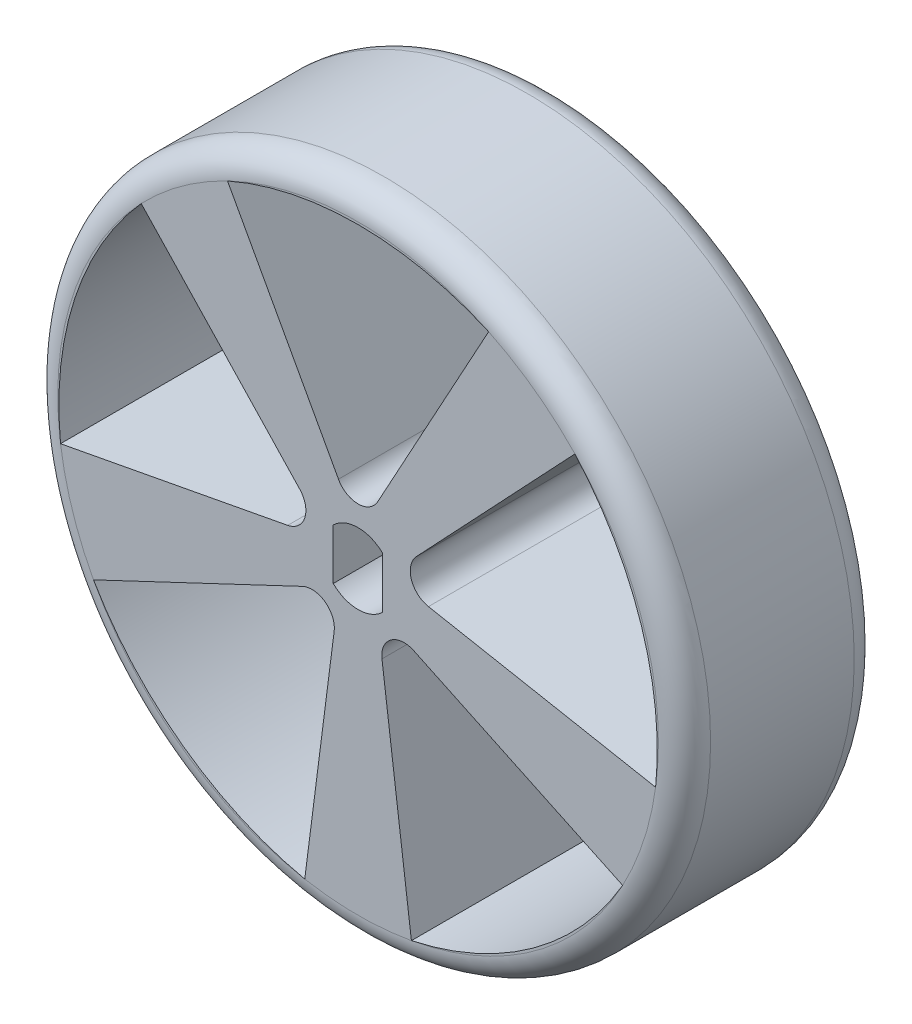
from build123d import *

# Parameters (mm, degrees)
SKETCH1_R           = 25
BOSS_EXTRUDE1_DEPTH = 15
FILLET1_R           = 2
CUT_EXTRUDE1_DEPTH  = 4
SKETCH7_R           = 1.04
CUT_EXTRUDE2_DEPTH  = 39.405728804
CUT_EXTRUDE3_REACH  = 40.406
CIRPATTERN1_COUNT   = 5


with BuildPart() as part:
    # Sketch1 → Boss-Extrude1 (new body)
    with BuildSketch(Plane.XY):
        Circle(SKETCH1_R)
    extrude(amount=BOSS_EXTRUDE1_DEPTH)

    # Fillet1
    fillet1_edges = [part.edges().sort_by_distance(p)[0] for p in [
        (-25, 0, 0),
        (-25, 0, 15),
    ]]
    fillet(fillet1_edges, radius=FILLET1_R)

    # Sketch4 → Cut-Extrude1 (cut)
    with BuildSketch(Plane.XY.offset(15)):
        with BuildLine():
            Line((-1.902969848, 1.941233493), (-1.902969848, -1.941233493))
            ThreePointArc((-1.902969848, -1.941233493), (-0.030378036, -2.71822716), (1.859110772, -1.983277302))
            Line((1.859110772, -1.983277302), (1.859110772, 1.983277302))
            ThreePointArc((1.859110772, 1.983277302), (-0.030378036, 2.71822716), (-1.902969848, 1.941233493))
        make_face()
    extrude(amount=-CUT_EXTRUDE1_DEPTH, mode=Mode.SUBTRACT)

    # Sketch7 → Cut-Extrude2 (cut, through all)
    with BuildSketch(Plane.XY.offset(15)):
        Circle(SKETCH7_R)
    extrude(amount=-CUT_EXTRUDE2_DEPTH, mode=Mode.SUBTRACT)

    # Sketch8 → Cut-Extrude3 (cut, up to next)
    with BuildSketch(Plane(origin=(0, 0, 0), x_dir=(-1, 0, 0), z_dir=(0, 0, -1)), mode=Mode.PRIVATE) as cut_extrude3_sk1:
        with BuildLine():
            Line((-1.5, 5.179174375), (-10, 20.712315177))
            ThreePointArc((-10, 20.712315177), (0, 22.821540356), (10, 20.712315177))
            Line((10, 20.712315177), (1.5, 5.179174375))
            ThreePointArc((1.5, 5.179174375), (0, 4.290100966), (-1.5, 5.179174375))
        make_face()
    cut_extrude3_tool1 = extrude(cut_extrude3_sk1.sketch, amount=-CUT_EXTRUDE3_REACH, mode=Mode.PRIVATE) & part.part
    cut_extrude3 = cut_extrude3_tool1.solids().sort_by_distance((0, 15.677953, 0))[0]
    add(cut_extrude3, mode=Mode.SUBTRACT)

    # CirPattern1: Cut-Extrude3 ×5 about axis
    cirpattern1_axis = Axis((0, 0, 0), (0, 0, 1))
    for i in range(1, CIRPATTERN1_COUNT):
        add(cut_extrude3.rotate(cirpattern1_axis, i * 360 / CIRPATTERN1_COUNT), mode=Mode.SUBTRACT)


solid = part.part
